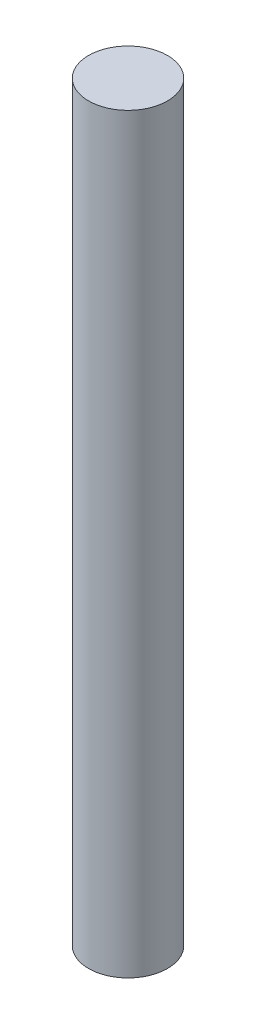
from build123d import *

# Parameters (mm, degrees)
SKETCH1_R           = 4
BOSS_EXTRUDE1_DEPTH = 76.2


with BuildPart() as part:
    # Sketch1 → Boss-Extrude1 (new body)
    with BuildSketch(Plane(origin=(0, 0, 0), x_dir=(1, 0, 0), z_dir=(0, 1, 0))):
        with Locations(Location((0, 0, 0), (0, 0, 90))):
            Circle(SKETCH1_R)
    extrude(amount=BOSS_EXTRUDE1_DEPTH)


solid = part.part
